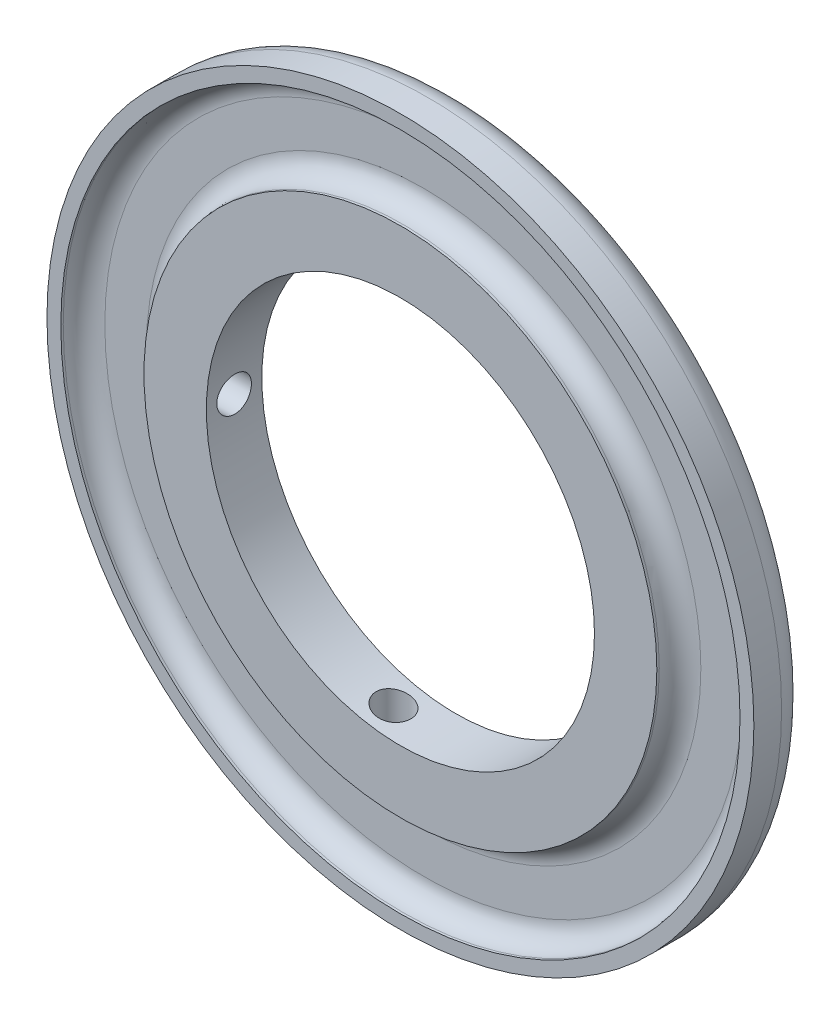
from build123d import *

# Parameters (mm, degrees)
SKETCH1_R           = 25.5
BOSS_EXTRUDE1_DEPTH = 4
SKETCH2_R           = 24.5
SKETCH2_R_2         = 18.5
CUT_EXTRUDE1_DEPTH  = 1.675
FILLET1_R           = 1.5
SKETCH3_R           = 14
CUT_EXTRUDE2_DEPTH  = 4
FILLET2_R           = 2
SKETCH4_R           = 1.25
CUT_EXTRUDE3_DEPTH  = 17
SKETCH5_R           = 1.25
CUT_EXTRUDE5_DEPTH  = 17


with BuildPart() as part:
    # Sketch1 → Boss-Extrude1 (new body)
    with BuildSketch(Plane.XY):
        Circle(SKETCH1_R)
    extrude(amount=BOSS_EXTRUDE1_DEPTH)

    # Sketch2 → Cut-Extrude1 (cut)
    with BuildSketch(Plane.XY.offset(4)):
        Circle(SKETCH2_R)
        Circle(SKETCH2_R_2, mode=Mode.SUBTRACT)
    extrude(amount=-CUT_EXTRUDE1_DEPTH, mode=Mode.SUBTRACT)

    # Fillet1
    fillet1_edges = [part.edges().sort_by_distance(p)[0] for p in [
        (-24.5, 0, 2.325),
        (-18.5, 0, 2.325),
    ]]
    fillet(fillet1_edges, radius=FILLET1_R)

    # Sketch3 → Cut-Extrude2 (cut)
    with BuildSketch(Plane.XY.offset(4)):
        Circle(SKETCH3_R)
    extrude(amount=-CUT_EXTRUDE2_DEPTH, mode=Mode.SUBTRACT)

    # Fillet2
    fillet2_edges = [part.edges().sort_by_distance(p)[0] for p in [
        (-25.5, 0, 0),
    ]]
    fillet(fillet2_edges, radius=FILLET2_R)

    # Sketch4 → Cut-Extrude3 (cut)
    with BuildSketch(Plane(origin=(0, 0, 0), x_dir=(0, 0, -1), z_dir=(1, 0, 0))):
        with Locations((-2, 0)):
            Circle(SKETCH4_R)
    extrude(amount=-CUT_EXTRUDE3_DEPTH, mode=Mode.SUBTRACT)

    # Sketch5 → Cut-Extrude5 (cut, symmetric)
    with BuildSketch(Plane(origin=(0, 0, 0), x_dir=(1, 0, 0), z_dir=(0, 1, 0))):
        with Locations(Location((-2.5, -2, 0), (0, 0, 270))):
            Circle(SKETCH5_R)
    extrude(amount=CUT_EXTRUDE5_DEPTH, both=True, mode=Mode.SUBTRACT)


solid = part.part
